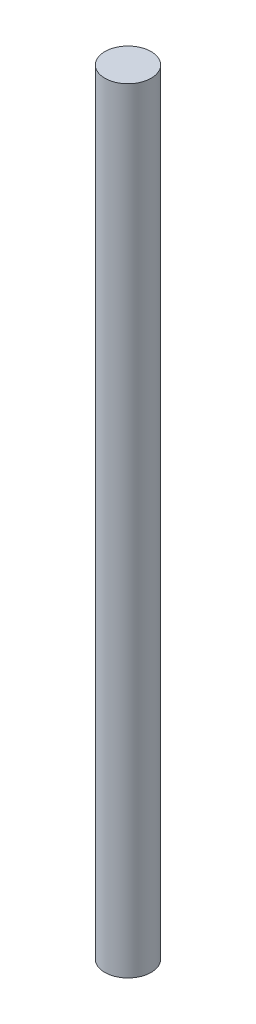
from build123d import *

# Parameters (mm, degrees)
SKETCH2_R = 3


with BuildPart() as part:
    # Sweep1: sweep along a path in Sketch1
    with BuildLine(Plane.XY) as sweep1_path:
        Line((0, 0), (0, 100.443459654))
    # Sketch2 → Sweep1 (sweep)
    with BuildSketch(Plane(origin=(0, 0, 0), x_dir=(1, 0, 0), z_dir=(0, 1, 0))):
        Circle(SKETCH2_R)
    sweep(path=sweep1_path.line)


solid = part.part
